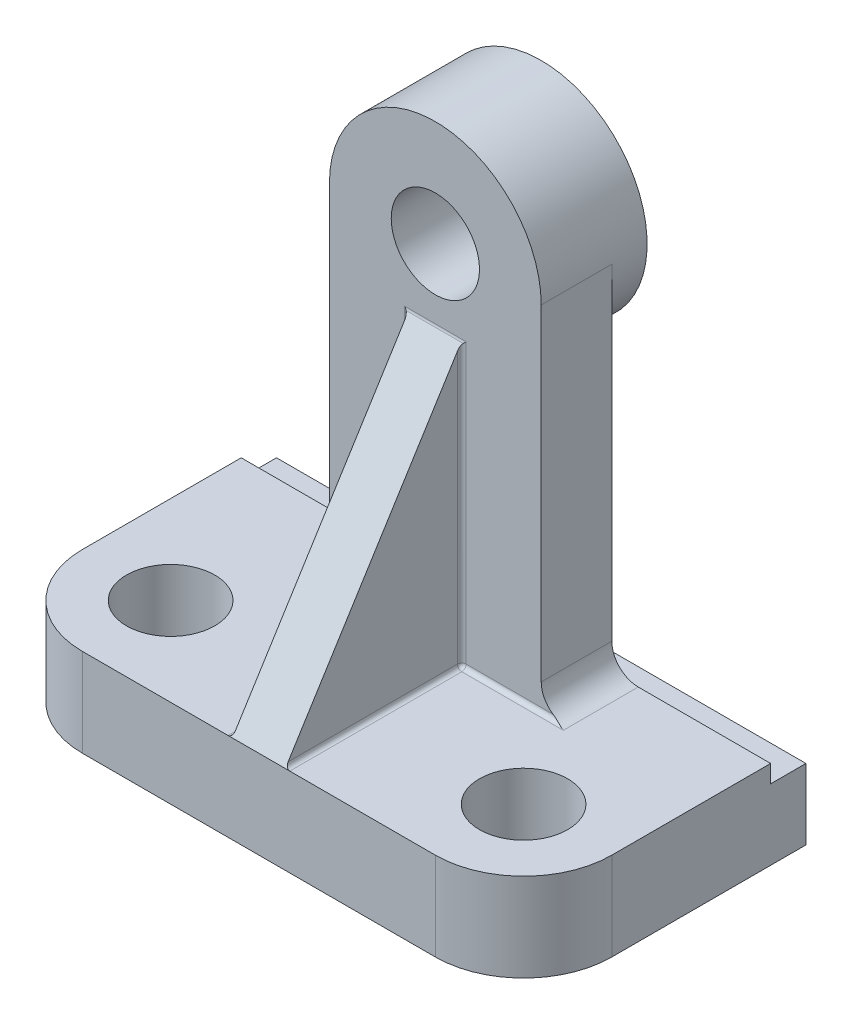
from build123d import *

# Parameters (mm, degrees)
SKETCH2_R           = 10
BOSS_EXTRUDE1_DEPTH = 20
SKETCH3_W           = 120
SKETCH3_H           = 8
CUT_EXTRUDE1_DEPTH  = 4
SKETCH7_R           = 10
BOSS_EXTRUDE2_DEPTH = 16
BOSS_EXTRUDE3_START = 8
SKETCH8_R           = 24
SKETCH8_R_2         = 10
BOSS_EXTRUDE3_DEPTH = 8
RIB4_REACH          = 153.895
SKETCH9_WALL_W      = 381.261249794
SKETCH9_WALL_H      = 12
FILLET2_R           = 1


with BuildPart() as part:
    # Sketch2 → Boss-Extrude1 (new body)
    with BuildSketch(Plane(origin=(0, 0, 0), x_dir=(1, 0, 0), z_dir=(0, 1, 0))):
        with BuildLine():
            Line((-64.708154955, 0), (15.291845045, 0))
            ThreePointArc((15.291845045, 0), (29.433980669, 5.857864376), (35.291845045, 20))
            Line((35.291845045, 20), (35.291845045, 64))
            Line((35.291845045, 64), (-84.708154955, 64))
            Line((-84.708154955, 64), (-84.708154955, 20))
            ThreePointArc((-84.708154955, 20), (-78.850290578, 5.857864376), (-64.708154955, 0))
        make_face()
        with Locations(Location((-64.708154955, 20, 0), (0, 0, 270))):
            Circle(SKETCH2_R, mode=Mode.SUBTRACT)
        with Locations(Location((15.291845045, 20, 0), (0, 0, 270))):
            Circle(SKETCH2_R, mode=Mode.SUBTRACT)
    extrude(amount=BOSS_EXTRUDE1_DEPTH)

    # Sketch3 → Cut-Extrude1 (cut)
    with BuildSketch(Plane(origin=(0, 20, 0), x_dir=(1, 0, 0), z_dir=(0, 1, 0))):
        with Locations((-24.708154955, 60)):
            Rectangle(SKETCH3_W, SKETCH3_H)
    extrude(amount=-CUT_EXTRUDE1_DEPTH, mode=Mode.SUBTRACT)

    # Sketch7 → Boss-Extrude2 (add)
    with BuildSketch(Plane(origin=(0, 0, -56), x_dir=(-1, 0, 0), z_dir=(0, 0, -1))):
        with BuildLine():
            Line((24.708154955, 20), (54.708154955, 20))
            ThreePointArc((54.708154955, 20), (50.465514267, 21.757359313), (48.708154955, 26))
            Line((48.708154955, 26), (48.708154955, 100))
            ThreePointArc((48.708154955, 100), (24.708154955, 124), (0.708154955, 100))
            Line((0.708154955, 100), (0.708154955, 26))
            ThreePointArc((0.708154955, 26), (-1.049204358, 21.757359313), (-5.291845045, 20))
            Line((-5.291845045, 20), (24.708154955, 20))
        make_face()
        with Locations((24.708154955, 100)):
            Circle(SKETCH7_R, mode=Mode.SUBTRACT)
    extrude(amount=-BOSS_EXTRUDE2_DEPTH)

    # Sketch8 → Boss-Extrude3 (add)
    with BuildSketch(Plane(origin=(0, 0, -56), x_dir=(-1, 0, 0), z_dir=(0, 0, -1)).offset(BOSS_EXTRUDE3_START)):
        with Locations((24.708154955, 100)):
            Circle(SKETCH8_R)
        with Locations((24.708154955, 100)):
            Circle(SKETCH8_R_2, mode=Mode.SUBTRACT)
    extrude(amount=-BOSS_EXTRUDE3_DEPTH)

    # Sketch9 wall → Rib4 (add, up to next)
    with BuildSketch(Plane(origin=(-24.708154955, 52, -20), x_dir=(0, 0.847998304005, -0.529998940003), z_dir=(0, -0.529998940003, -0.847998304005)), mode=Mode.PRIVATE) as rib4_sk1:
        Rectangle(SKETCH9_WALL_W, SKETCH9_WALL_H)
    rib4_tool1 = extrude(rib4_sk1.sketch, amount=RIB4_REACH, mode=Mode.PRIVATE) - part.part
    add(rib4_tool1.solids().sort_by_distance((-24.708154955, 52, -20))[0])

    # Fillet2
    fillet2_edges = [part.edges().sort_by_distance(p)[0] for p in [
        (-6.708154955, 20, -40),
        (-42.708154955, 20, -40),
        (-24.708154955, 84, -40),
        (-30.708154955, 20, -20),
        (-30.708154955, 52, -40),
        (-18.708154955, 52, -40),
        (-18.708154955, 20, -20),
    ]]
    fillet(fillet2_edges, radius=FILLET2_R)


solid = part.part
